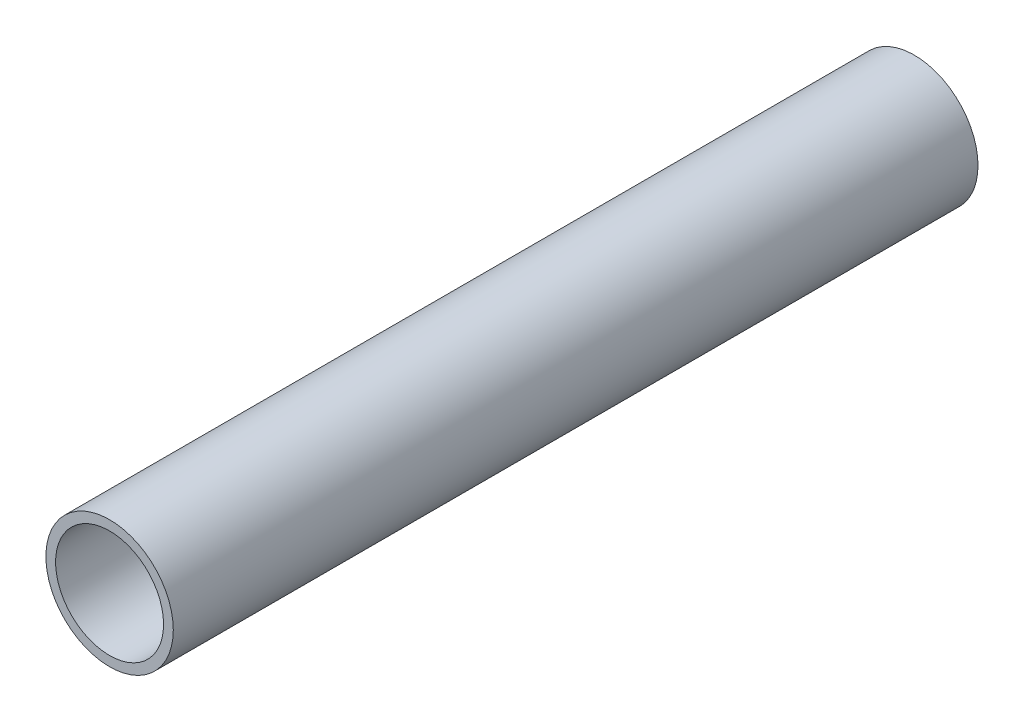
from build123d import *

# Parameters (mm, degrees)
BOSS_EXTRUDE1_DEPTH      = 152.4
BOSS_EXTRUDE1_DEPTH_BACK = 152.4
SKETCH3_R                = 24.13
SKETCH3_R_2              = 20.447


with BuildPart() as part:
    # Sketch3 → Boss-Extrude1 (new, two sides: drawn at the far end of the back side and taken through both)
    with BuildSketch(Plane.XY.offset(-BOSS_EXTRUDE1_DEPTH_BACK)):
        Circle(SKETCH3_R)
        Circle(SKETCH3_R_2, mode=Mode.SUBTRACT)
    extrude(amount=BOSS_EXTRUDE1_DEPTH + BOSS_EXTRUDE1_DEPTH_BACK)


solid = part.part
